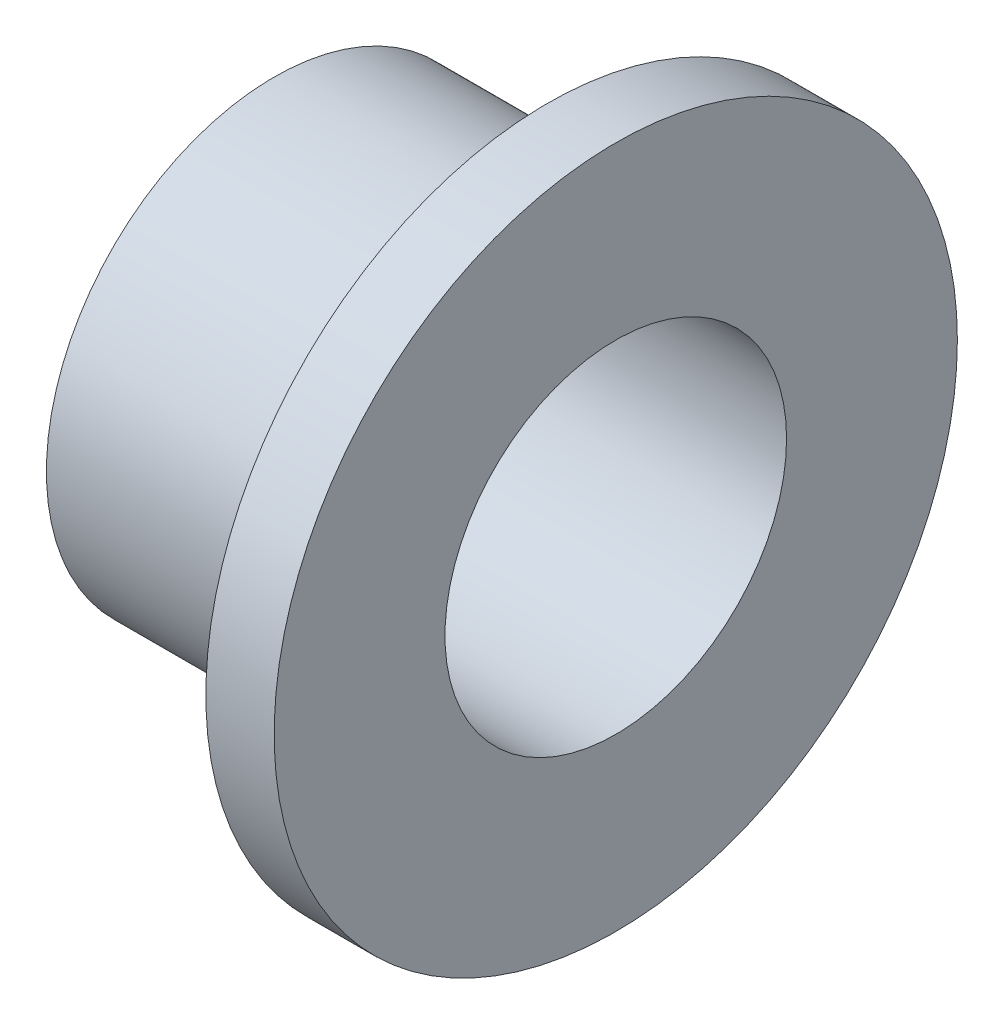
from build123d import *


with BuildPart() as part:
    # Croquis1 → Revolución1 (revolve)
    with BuildSketch(Plane(origin=(0, 0, 0), x_dir=(-1, 0, 0), z_dir=(0, 1, 0)), mode=Mode.PRIVATE) as revoluci_n1_sk:
        Polygon((0, 6), (0, 3), (6, 3), (6, 4), (1.2, 4), (1.2, 6), align=None)
    revolve(revoluci_n1_sk.sketch.rotate(Axis((0, 0, 0), (-1, 0, 0)), 180), axis=Axis((0, 0, 0), (-1, 0, 0)))


solid = part.part
